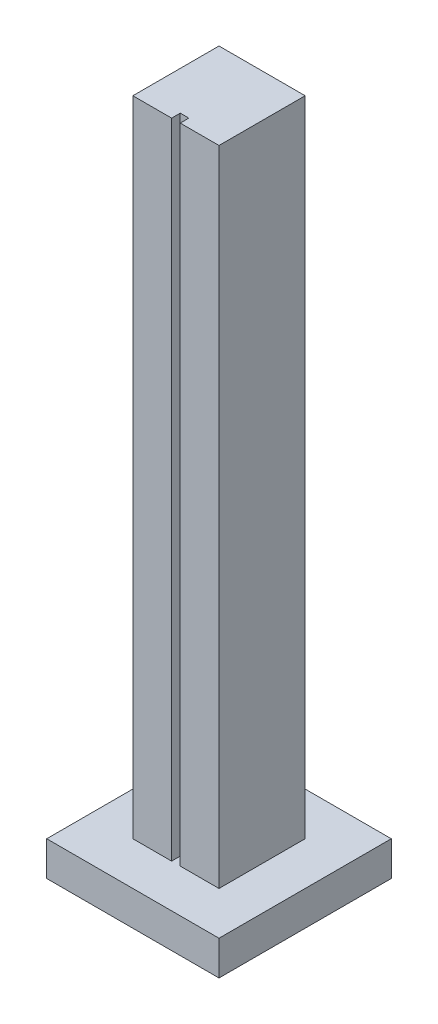
from build123d import *

# Parameters (mm, degrees)
BOSS_EXTRUDE1_DEPTH = 78.7
SKETCH2_W           = 20
SKETCH2_H           = 20
BOSS_EXTRUDE2_DEPTH = 4


with BuildPart() as part:
    # Sketch1 → Boss-Extrude1 (new body)
    with BuildSketch(Plane(origin=(0, 0, 0), x_dir=(1, 0, 0), z_dir=(0, 1, 0))):
        Polygon((4.5, 0), (4.5, 1), (5.5, 1), (5.5, 0), (10, 0), (10, 10), (0, 10), (0, 0), align=None)
    extrude(amount=BOSS_EXTRUDE1_DEPTH)

    # Sketch2 → Boss-Extrude2 (add)
    with BuildSketch(Plane(origin=(0, 0, 0), x_dir=(1, 0, 0), z_dir=(0, 1, 0))):
        with Locations((5, 5)):
            Rectangle(SKETCH2_W, SKETCH2_H)
    extrude(amount=BOSS_EXTRUDE2_DEPTH)


solid = part.part
